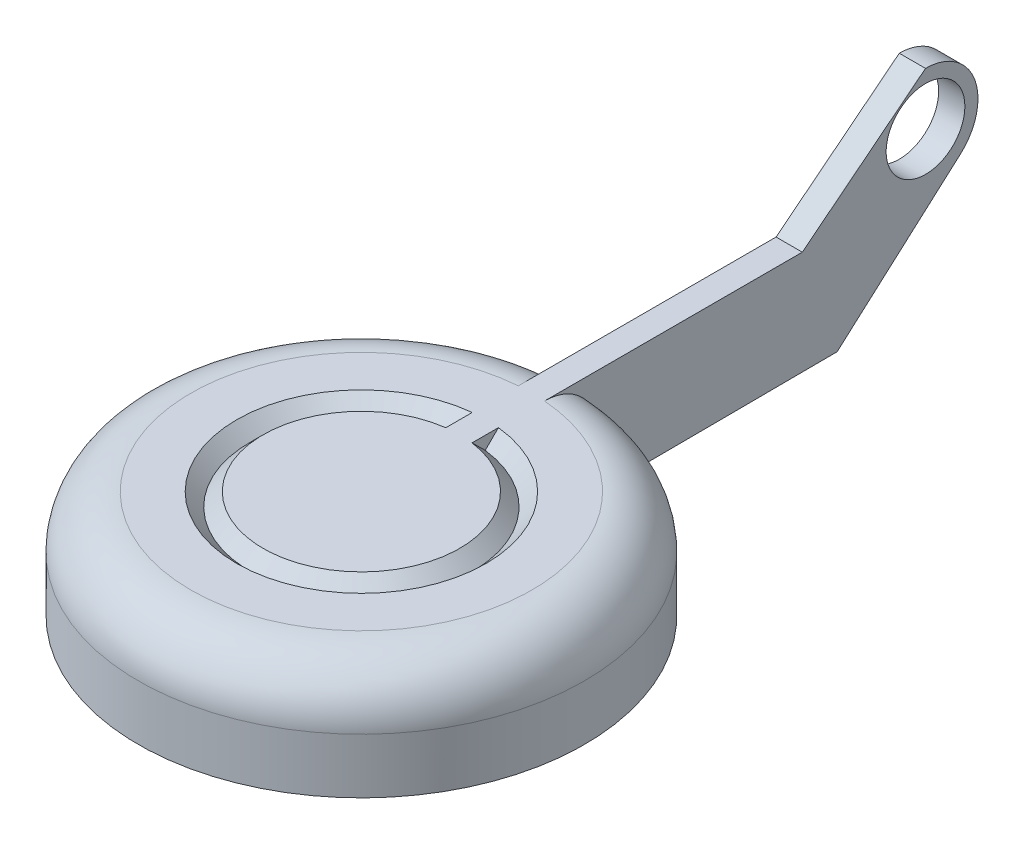
from build123d import *

# Parameters (mm, degrees)
FILLET1_R                = 2
SKETCH5_R                = 8.5
SKETCH5_R_2              = 7
BOSS_EXTRUDE1_DEPTH      = 0.1
BOSS_EXTRUDE2_DEPTH      = 0.5
BOSS_EXTRUDE2_DEPTH_BACK = 0.5
SKETCH6_R                = 1.5


with BuildPart() as part:
    # Sketch4 → Revolve1 (revolve)
    with BuildSketch(Plane(origin=(0, 0, 0), x_dir=(0, 0, -1), z_dir=(1, 0, 0))):
        Polygon((0, 0), (-3.75, 0), (-4.25, -0.5), (-4.75, 0), (-8.5, 0), (-8.5, -4), (0, -4), align=None)
    revolve(axis=Axis((0, 1.890471386, 0), (0, -1, 0)))

    # Fillet1
    fillet1_edges = [part.edges().sort_by_distance(p)[0] for p in [
        (0, 0, -8.5),
    ]]
    fillet(fillet1_edges, radius=FILLET1_R)



with BuildPart() as body_2:
    # Sketch5 → Boss-Extrude1 (new body)
    with BuildSketch(Plane.XZ.offset(4)):
        Circle(SKETCH5_R)
        Circle(SKETCH5_R_2, mode=Mode.SUBTRACT)
    extrude(amount=BOSS_EXTRUDE1_DEPTH)


with BuildPart() as part_1:
    add(part.part)

    add(body_2.part)  # Boss-Extrude2 merges body 2
    # Sketch6 → Boss-Extrude2 (add, two sides: drawn at the far end of the back side and taken through both)
    with BuildSketch(Plane(origin=(0, 0, 0), x_dir=(0, 0, -1), z_dir=(1, 0, 0)).offset(-BOSS_EXTRUDE2_DEPTH_BACK)):
        with BuildLine():
            Line((16.303953204, 0), (0, 0))
            Line((0, 0), (0, -0.907670556))
            Line((0, -0.907670556), (7.174444166, -0.907670556))
            Line((7.174444166, -0.907670556), (8.5, -4))
            Line((8.5, -4), (17.632863069, -3.95))
            Line((17.632863069, -3.95), (22.328664529, 0.223690648))
            ThreePointArc((22.328664529, 0.223690648), (22.869458415, 2.429287044), (21, 3.718565415))
            Line((21, 3.718565415), (16.303953204, 0))
        make_face()
        with Locations((21, 1.718565415)):
            Circle(SKETCH6_R, mode=Mode.SUBTRACT)
    extrude(amount=BOSS_EXTRUDE2_DEPTH + BOSS_EXTRUDE2_DEPTH_BACK)


solid = part_1.part
